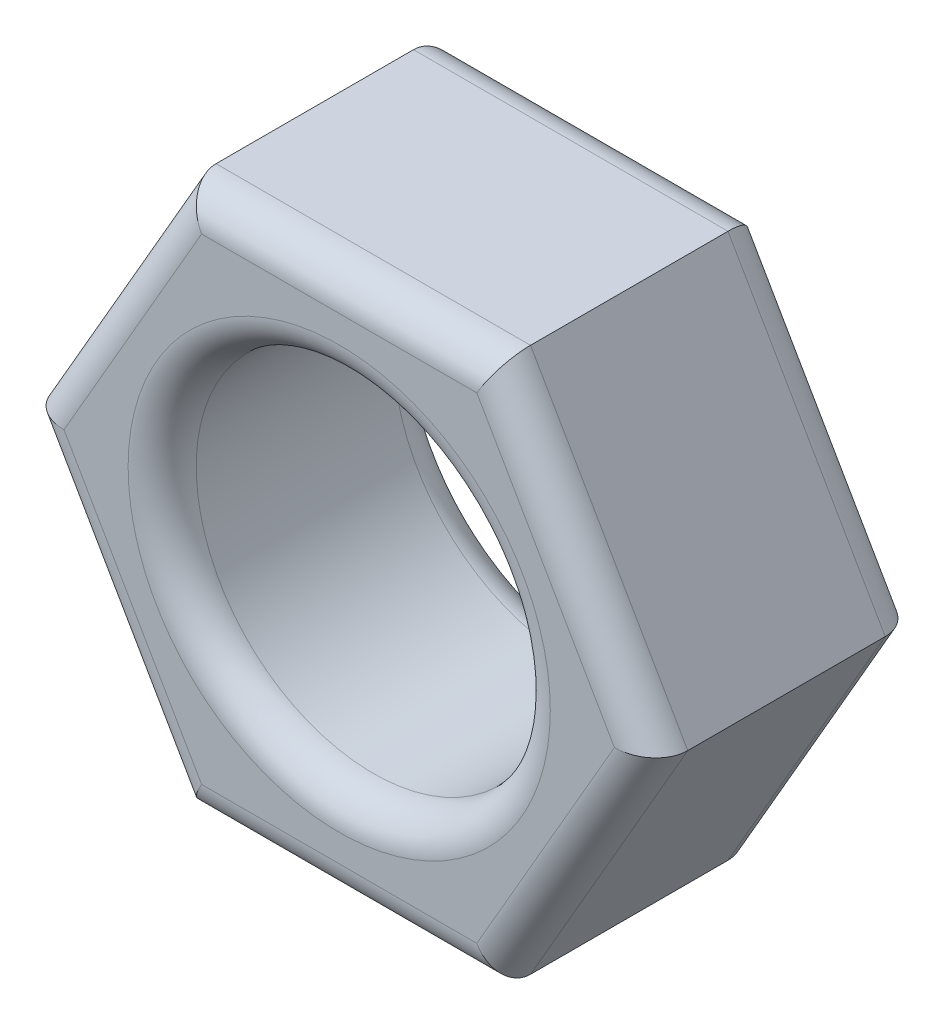
from build123d import *

# Parameters (mm, degrees)
SKETCH_1_R      = 2.6
EXTRUDE_1_DEPTH = 3.9
FILLET_1_R      = 0.5


with BuildPart() as part:
    # 草图1 → 凸台-拉伸1 (new body)
    with BuildSketch(Plane.XY):
        Polygon((4.618802154, 0), (2.309401077, 4), (-2.309401077, 4), (-4.618802154, 0), (-2.309401077, -4), (2.309401077, -4), align=None)
        Circle(SKETCH_1_R, mode=Mode.SUBTRACT)
    extrude(amount=EXTRUDE_1_DEPTH)

    # 圆角1
    fillet_1_edges = [part.edges().sort_by_distance(p)[0] for p in [
        (0, 4, 3.9),
        (-3.464101615, 2, 3.9),
        (-2.6, 0, 0),
        (-2.6, 0, 3.9),
        (-3.464101615, -2, 3.9),
        (0, -4, 3.9),
        (3.464101615, -2, 3.9),
        (0, -4, 0),
        (-3.464101615, -2, 0),
        (-3.464101615, 2, 0),
        (0, 4, 0),
        (3.464101615, 2, 0),
        (3.464101615, -2, 0),
        (3.464101615, 2, 3.9),
    ]]
    fillet(fillet_1_edges, radius=FILLET_1_R)


solid = part.part
